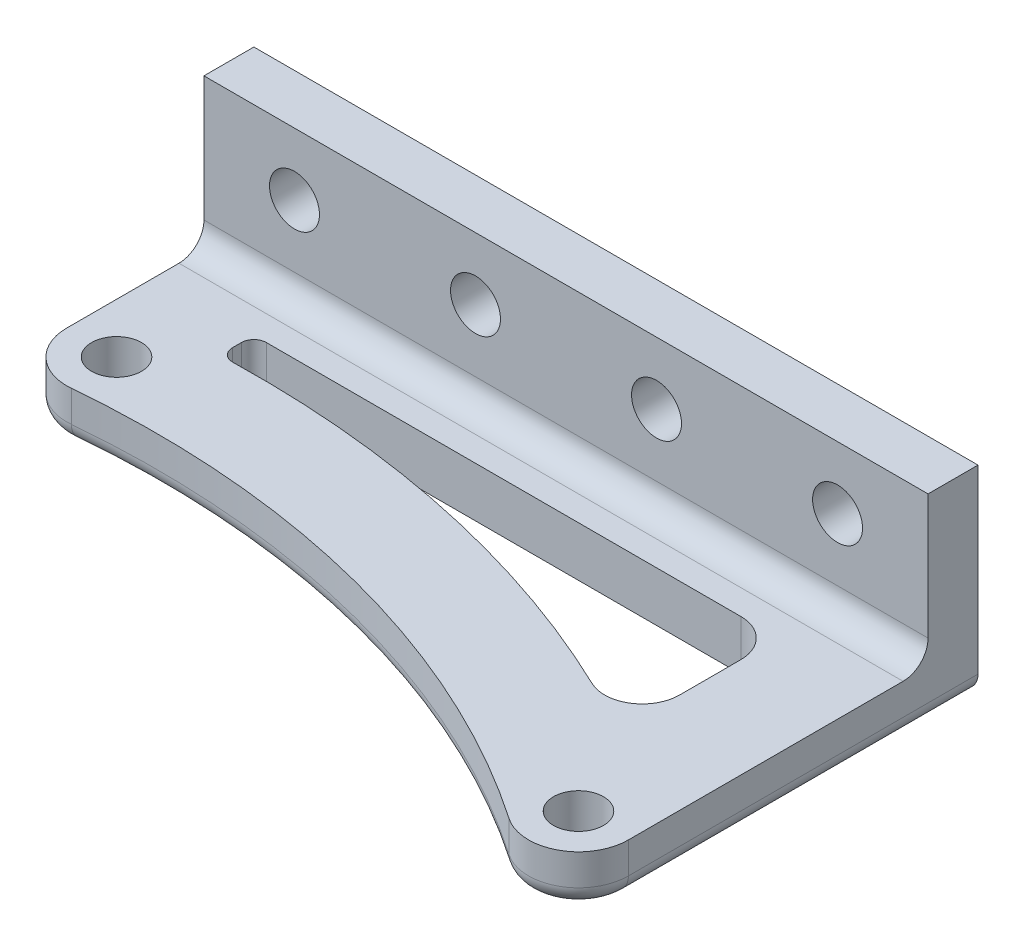
from build123d import *

# Parameters (mm, degrees)
SKETCH1_R           = 2
BOSS_EXTRUDE1_DEPTH = 4
SKETCH2_W           = 58
SKETCH2_H           = 4
BOSS_EXTRUDE2_DEPTH = 12
FILLET2_R           = 2
FILLET4_R           = 1.5
SKETCH4_R           = 2
CUT_EXTRUDE1_DEPTH  = 4


with BuildPart() as part:
    # Sketch1 → Boss-Extrude1 (new body)
    with BuildSketch(Plane(origin=(0, 0, 0), x_dir=(1, 0, 0), z_dir=(0, 1, 0))):
        with BuildLine():
            Line((-4, 13), (-4, 28))
            Line((-4, 28), (54, 28))
            Line((54, 28), (54, 0))
            ThreePointArc((54, 0), (51.867813839, -3.537127572), (47.744364269, -3.303347915))
            ThreePointArc((47.744364269, -3.303347915), (25.12511084, 6.98119554), (0.361009591, 9.016324301))
            ThreePointArc((0.361009591, 9.016324301), (-2.697773307, 10.046693517), (-4, 13))
        make_face()
        with Locations(Location((0, 13, 0), (0, 0, 270))):
            Circle(SKETCH1_R, mode=Mode.SUBTRACT)
        with Locations(Location((50, 0, 0), (0, 0, 270))):
            Circle(SKETCH1_R, mode=Mode.SUBTRACT)
        with BuildLine():
            Line((4, 18.289802574), (4, 19))
            ThreePointArc((4, 19), (4.292893219, 19.707106781), (5, 20))
            Line((5, 20), (25, 20))
            Line((25, 20), (43, 20))
            ThreePointArc((43, 20), (45.121320344, 19.121320344), (46, 17))
            Line((46, 17), (46, 12.096928721))
            ThreePointArc((46, 12.096928721), (44.597765919, 9.557806024), (41.701903954, 9.392312916))
            ThreePointArc((41.701903954, 9.392312916), (23.829546608, 15.509740284), (5.023311328, 17.29007432))
            ThreePointArc((5.023311328, 17.29007432), (4.301183618, 17.574501474), (4, 18.289802574))
        make_face(mode=Mode.SUBTRACT)
    extrude(amount=BOSS_EXTRUDE1_DEPTH)

    # Sketch2 → Boss-Extrude2 (add)
    with BuildSketch(Plane(origin=(0, 4, 0), x_dir=(1, 0, 0), z_dir=(0, 1, 0))):
        with Locations((25, 26)):
            Rectangle(SKETCH2_W, SKETCH2_H)
    extrude(amount=BOSS_EXTRUDE2_DEPTH)

    # Fillet2
    fillet2_edges = [part.edges().sort_by_distance(p)[0] for p in [
        (25, 4, -24),
    ]]
    fillet(fillet2_edges, radius=FILLET2_R)

    # Fillet4
    fillet4_edges = [part.edges().sort_by_distance(p)[0] for p in [
        (-4, 0, -20.5),
        (54, 0, -14),
        (51.867813839, 0, 3.537127572),
        (25.12511084, 0, -6.98119554),
        (-2.697773307, 0, -10.046693517),
    ]]
    fillet(fillet4_edges, radius=FILLET4_R)

    # Sketch4 → Cut-Extrude1 (cut)
    with BuildSketch(Plane.XY.offset(-24)):
        with Locations((17.75, 11)):
            Circle(SKETCH4_R)
        with Locations((32.25, 11)):
            Circle(SKETCH4_R)
        with Locations((46.75, 11)):
            Circle(SKETCH4_R)
        with Locations((3.25, 11)):
            Circle(SKETCH4_R)
    extrude(amount=-CUT_EXTRUDE1_DEPTH, mode=Mode.SUBTRACT)


solid = part.part
